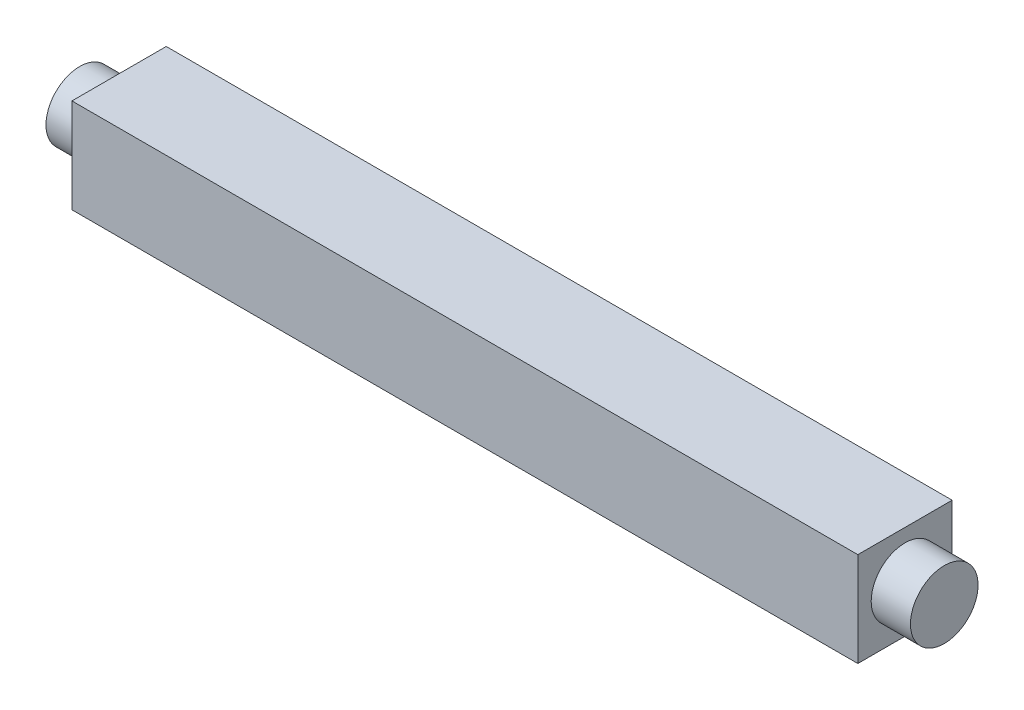
from build123d import *

# Parameters (mm, degrees)
SKETCH_1_W             = 50
SKETCH_1_H             = 6
EXTRUDE_1_DEPTH        = 6
SKETCH_2_R             = 2.15
EXTRUDE_2_DEPTH        = 2.5
PATTERN_LINEAR_1_COUNT = 2
PATTERN_LINEAR_1_PITCH = 52.5


with BuildPart() as part:
    # 草圖1 → 填料-伸長1 (new body)
    with BuildSketch(Plane.XY):
        with Locations((25, 3)):
            Rectangle(SKETCH_1_W, SKETCH_1_H)
    extrude(amount=EXTRUDE_1_DEPTH)

    # 草圖2 → 填料-伸長2 (add)
    with BuildSketch(Plane.ZY):
        with Locations((3, 3)):
            Circle(SKETCH_2_R)
    extrude_2 = extrude(amount=EXTRUDE_2_DEPTH)

    # 直線複製排列1: 填料-伸長2 ×2
    with Locations(*[(i * PATTERN_LINEAR_1_PITCH, 0, 0) for i in range(1, PATTERN_LINEAR_1_COUNT)]):
        add(extrude_2)


solid = part.part
